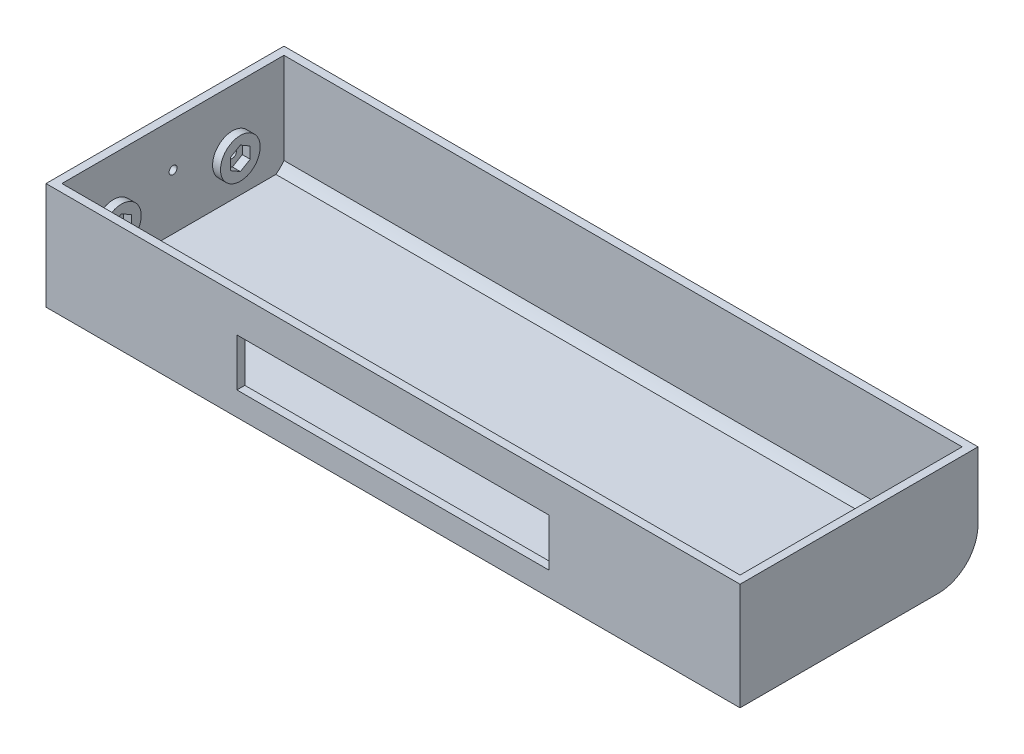
from build123d import *

# Parameters (mm, degrees)
SKETCH1_W              = 175
SKETCH1_H              = 60
SKETCH1_W_2            = 171
SKETCH1_H_2            = 56
BOSS_EXTRUDE1_DEPTH    = 25
SKETCH1_2_W            = 175
SKETCH1_2_H            = 60
BOSS_EXTRUDE2_DEPTH    = 2
SKETCH3_W              = 78.730351058
SKETCH3_H              = 12.02010903
CUT_EXTRUDE2_DEPTH     = 2
SKETCH5_W              = 56
SKETCH5_H              = 18
SKETCH5_R              = 5
BOSS_EXTRUDE3_DEPTH    = 2
SKETCH5_4_R            = 5
BOSS_EXTRUDE4_DEPTH    = 6
BOSS_EXTRUDE4_2_DEPTH  = 6
SKETCH9_R              = 3
CUT_EXTRUDE3_DEPTH     = 2
SKETCH9_3_R            = 3
BOSS_EXTRUDE5_DEPTH    = 2
SKETCH6_W              = 3
SKETCH6_H              = 3
CUT_EXTRUDE4_DEPTH     = 2
SKETCH8_R              = 1
CUT_EXTRUDE5_DEPTH     = 2
BOSS_EXTRUDE8_START    = 2
SKETCH10_R             = 5
BOSS_EXTRUDE8_DEPTH    = 2
SKETCH11_R             = 3
SKETCH11_W             = 3
SKETCH11_H             = 3
CUT_EXTRUDE6_DEPTH     = 2
SKETCH11_3_R           = 3
SKETCH11_3_W           = 3
SKETCH11_3_H           = 3
BOSS_EXTRUDE9_DEPTH    = 2
SKETCH12_R             = 1
CUT_EXTRUDE7_DEPTH     = 2
SKETCH13_R             = 1
BOSS_EXTRUDE10_DEPTH   = 5
SKETCH14_R             = 3
SKETCH14_R_2           = 2
BOSS_EXTRUDE11_DEPTH   = 4.5
FILLET1_R              = 10
SKETCH15_R             = 1
BOSS_EXTRUDE12_DEPTH   = 10
BOSS_EXTRUDE12_2_DEPTH = 10
BOSS_EXTRUDE12_3_DEPTH = 10
SKETCH16_R             = 1
CUT_EXTRUDE9_DEPTH     = 3


with BuildPart() as part:
    # Sketch1 → Boss-Extrude1 (new body)
    with BuildSketch(Plane(origin=(0, 0, 0), x_dir=(1, 0, 0), z_dir=(0, 1, 0))):
        with Locations((0, -2.874293785)):
            Rectangle(SKETCH1_W, SKETCH1_H)
        with Locations((0, -2.874293785)):
            Rectangle(SKETCH1_W_2, SKETCH1_H_2, mode=Mode.SUBTRACT)
    extrude(amount=BOSS_EXTRUDE1_DEPTH)

    # Sketch1<2> → Boss-Extrude2 (add)
    with BuildSketch(Plane(origin=(0, 0, 0), x_dir=(1, 0, 0), z_dir=(0, 1, 0))):
        with Locations((0, -2.874293785)):
            Rectangle(SKETCH1_2_W, SKETCH1_2_H)
    extrude(amount=-BOSS_EXTRUDE2_DEPTH)

    # Sketch3 → Cut-Extrude2 (cut)
    with BuildSketch(Plane.XY.offset(32.874293785)):
        with Locations((0, 10)):
            Rectangle(SKETCH3_W, SKETCH3_H)
    extrude(amount=-CUT_EXTRUDE2_DEPTH, mode=Mode.SUBTRACT)

    # Sketch5 → Boss-Extrude3 (add)
    with BuildSketch(Plane.ZY.offset(-85.5)):
        with Locations((2.874293785, 11)):
            Rectangle(SKETCH5_W, SKETCH5_H)
        with Locations((17.874293785, 10)):
            Circle(SKETCH5_R, mode=Mode.SUBTRACT)
        with Locations((-12.125706215, 10)):
            Circle(SKETCH5_R, mode=Mode.SUBTRACT)
    extrude(amount=BOSS_EXTRUDE3_DEPTH)

    # Sketch8 → Cut-Extrude5 (cut)
    with BuildSketch(Plane.ZY.offset(87.5)):
        with Locations((-12.125706215, 10)):
            Circle(SKETCH8_R)
    cut_extrude5 = extrude(amount=-CUT_EXTRUDE5_DEPTH, mode=Mode.SUBTRACT)

    # Sketch10 → Boss-Extrude8 (add)
    with BuildSketch(Plane(origin=(-85.5, 0, 0), x_dir=(0, 0, -1), z_dir=(1, 0, 0)).offset(BOSS_EXTRUDE8_START)):
        with Locations(Location((12.125706215, 10, 0), (0, 0, 180))):
            Circle(SKETCH10_R)
        Polygon((12.125706215, 12.886751346), (9.625706215, 11.443375673), (9.625706215, 8.556624327), (12.125706215, 7.113248654), (14.625706215, 8.556624327), (14.625706215, 11.443375673), align=None, mode=Mode.SUBTRACT)
    boss_extrude8 = extrude(amount=-BOSS_EXTRUDE8_DEPTH)

    # Mirror1: Cut-Extrude5, Boss-Extrude8 across plane
    add(cut_extrude5.mirror(Plane.XY.offset(2.874293785)), mode=Mode.SUBTRACT)
    add(boss_extrude8.mirror(Plane.XY.offset(2.874293785)))

    # Sketch12 → Cut-Extrude7 (cut)
    with BuildSketch(Plane.ZY.offset(87.5)):
        with Locations((2.832267692, 13.914049176)):
            Circle(SKETCH12_R)
    extrude(amount=-CUT_EXTRUDE7_DEPTH, mode=Mode.SUBTRACT)

    # Sketch13 → Boss-Extrude10 (add, symmetric)
    with BuildSketch(Plane.ZY.offset(87.5)):
        with Locations(Location((-27.48796233, 9.572637011, 0), (0, 0, 68.76118338))):
            Circle(SKETCH13_R)
    extrude(amount=BOSS_EXTRUDE10_DEPTH, both=True)

    # Fillet1
    fillet1_edges = [part.edges().sort_by_distance(p)[0] for p in [
        (0, -2, -27.125706215),
    ]]
    fillet(fillet1_edges, radius=FILLET1_R)


with BuildPart() as body_2:
    # Sketch5<4> → Boss-Extrude4 (new body)
    with BuildSketch(Plane.ZY.offset(-85.5)):
        with Locations((17.874293785, 10)):
            Circle(SKETCH5_4_R)
    extrude(amount=BOSS_EXTRUDE4_DEPTH)

    # Sketch11 → Cut-Extrude6 (cut)
    # profile 1 of 2: a face of its own
    with BuildSketch(Plane.ZY.offset(-79.5)):
        with Locations((17.874293785, 10)):
            Circle(SKETCH11_R)
        with Locations((17.874293785, 10)):
            Rectangle(SKETCH11_W, SKETCH11_H, mode=Mode.SUBTRACT)
    # profile 2 of 2: a face of its own
    with BuildSketch(Plane.ZY.offset(-79.5)):
        with Locations((17.874293785, 10)):
            Rectangle(SKETCH11_W, SKETCH11_H)
    extrude(amount=-CUT_EXTRUDE6_DEPTH, mode=Mode.SUBTRACT)


with BuildPart() as body_3:
    # Sketch5<4> → Boss-Extrude4 2 (new body)
    with BuildSketch(Plane.ZY.offset(-85.5)):
        with Locations((-12.125706215, 10)):
            Circle(SKETCH5_4_R)
    extrude(amount=BOSS_EXTRUDE4_2_DEPTH)

    # Sketch9 → Cut-Extrude3 (cut)
    with BuildSketch(Plane.ZY.offset(-79.5)):
        with Locations((-12.125706215, 10)):
            Circle(SKETCH9_R)
    extrude(amount=-CUT_EXTRUDE3_DEPTH, mode=Mode.SUBTRACT)


with BuildPart() as body_4:
    # Sketch9<3> → Boss-Extrude5 (new body)
    with BuildSketch(Plane.ZY.offset(-79.5)):
        with Locations((-12.125706215, 10)):
            Circle(SKETCH9_3_R)
    extrude(amount=-BOSS_EXTRUDE5_DEPTH)

    # Sketch6 → Cut-Extrude4 (cut)
    with BuildSketch(Plane.ZY.offset(-79.5)):
        with Locations((-12.125706215, 10)):
            Rectangle(SKETCH6_W, SKETCH6_H)
    extrude(amount=-CUT_EXTRUDE4_DEPTH, mode=Mode.SUBTRACT)


with BuildPart() as body_5:
    # Sketch11<3> → Boss-Extrude9 (new body)
    with BuildSketch(Plane.ZY.offset(-79.5)):
        with Locations((17.874293785, 10)):
            Circle(SKETCH11_3_R)
        with Locations((17.874293785, 10)):
            Rectangle(SKETCH11_3_W, SKETCH11_3_H, mode=Mode.SUBTRACT)
    extrude(amount=-BOSS_EXTRUDE9_DEPTH)


with BuildPart() as body_6:
    # Sketch14 → Boss-Extrude11 (new, symmetric)
    with BuildSketch(Plane.ZY.offset(92.5)):
        with Locations((-27.48796233, 9.572637011)):
            Circle(SKETCH14_R)
        with Locations((-27.48796233, 9.572637011)):
            Circle(SKETCH14_R_2, mode=Mode.SUBTRACT)
    extrude(amount=BOSS_EXTRUDE11_DEPTH, both=True)

    # Sketch16 → Cut-Extrude9 (cut)
    with BuildSketch(Plane(origin=(0, -8.781042983, -16.580502058), x_dir=(1, 0, 0), z_dir=(0, 0.4680180244417621, 0.8837189195652826))):
        with Locations(Location((-95.5, 21.324382263, 0), (0, 0, 90))):
            Circle(SKETCH16_R)
    extrude(amount=CUT_EXTRUDE9_DEPTH, mode=Mode.SUBTRACT)


with BuildPart() as body_7:
    # Sketch15 → Boss-Extrude12 (new body)
    with BuildSketch(Plane.ZY.offset(87.5)):
        with Locations((-12.125706215, 10)):
            Circle(SKETCH15_R)
    extrude(amount=BOSS_EXTRUDE12_DEPTH)


with BuildPart() as body_8:
    # Sketch15 → Boss-Extrude12 2 (new body)
    with BuildSketch(Plane.ZY.offset(87.5)):
        with Locations((2.832267692, 13.914049176)):
            Circle(SKETCH15_R)
    extrude(amount=BOSS_EXTRUDE12_2_DEPTH)


with BuildPart() as body_9:
    # Sketch15 → Boss-Extrude12 3 (new body)
    with BuildSketch(Plane.ZY.offset(87.5)):
        with Locations((17.874293785, 10)):
            Circle(SKETCH15_R)
    extrude(amount=BOSS_EXTRUDE12_3_DEPTH)


solid = Compound([part.part, body_2.part, body_3.part, body_4.part, body_5.part, body_6.part, body_7.part, body_8.part, body_9.part])
